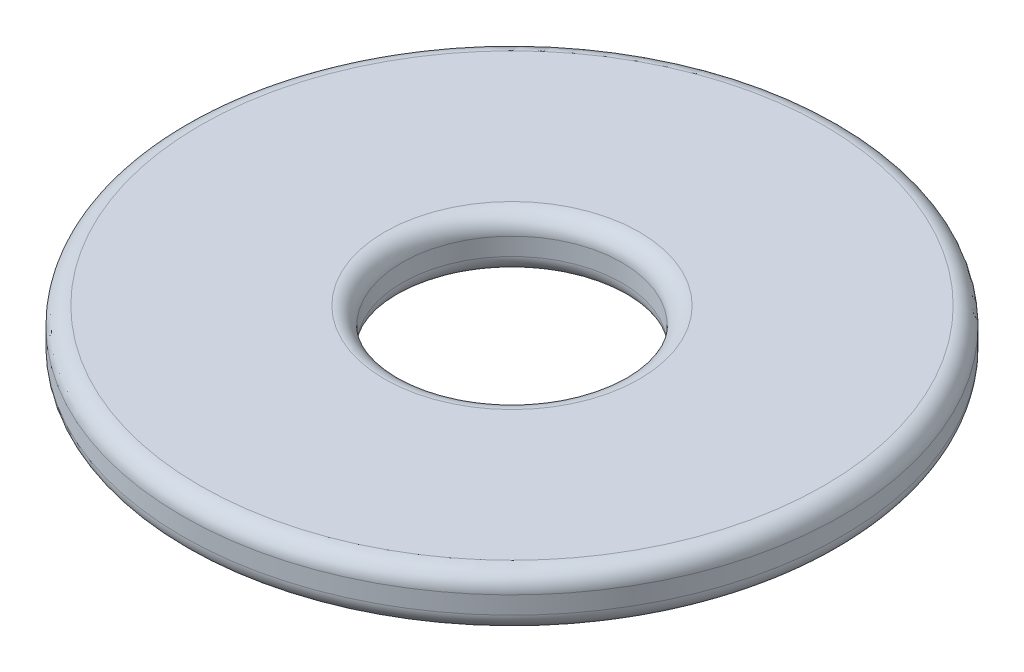
from build123d import *

# Parameters (mm, degrees)
SKETCH1_R           = 7.5
SKETCH1_R_2         = 2.5
BOSS_EXTRUDE1_DEPTH = 1.2
FILLET1_R           = 0.4


with BuildPart() as part:
    # Sketch1 → Boss-Extrude1 (new body)
    with BuildSketch(Plane(origin=(0, 0, 0), x_dir=(1, 0, 0), z_dir=(0, 1, 0))):
        with Locations(Location((0, 0, 0), (0, 0, 270))):
            Circle(SKETCH1_R)
        with Locations(Location((0, 0, 0), (0, 0, 270))):
            Circle(SKETCH1_R_2, mode=Mode.SUBTRACT)
    extrude(amount=BOSS_EXTRUDE1_DEPTH)

    # Fillet1
    fillet1_edges = [part.edges().sort_by_distance(p)[0] for p in [
        (0, 0, -7.5),
        (0, 1.2, -7.5),
        (0, 0, -2.5),
        (0, 1.2, -2.5),
    ]]
    fillet(fillet1_edges, radius=FILLET1_R)


solid = part.part
